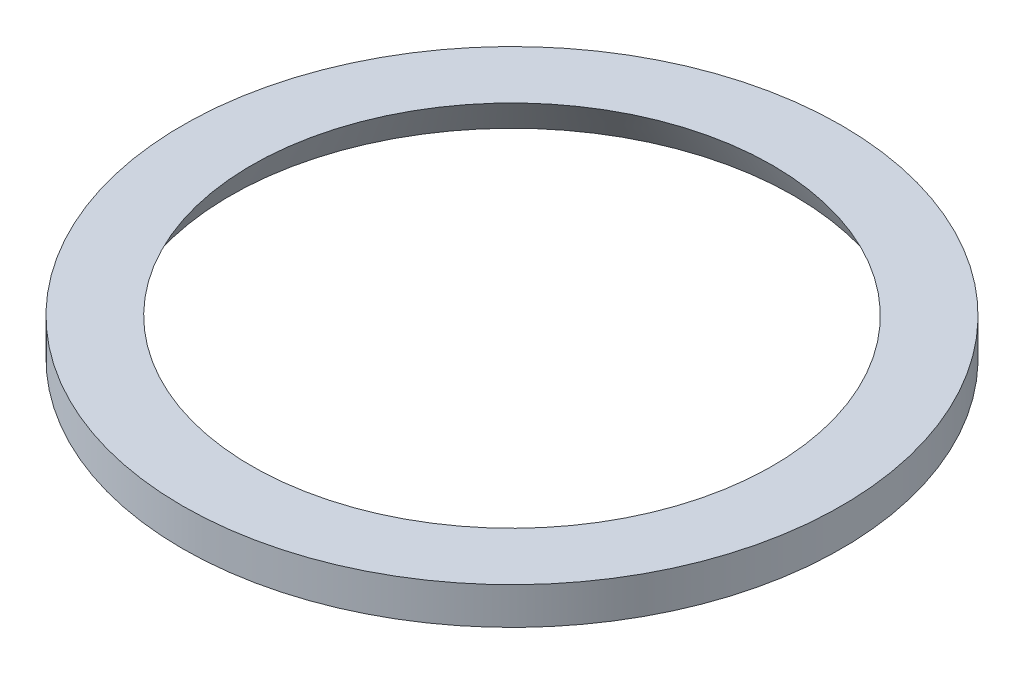
from build123d import *


with BuildPart() as part:
    # Sketch2 → Revolve1 (revolve)
    with BuildSketch(Plane.XY, mode=Mode.PRIVATE) as revolve1_sk:
        Polygon((-89, 0), (-89, 10), (-70.339745962, 10), (-76.113248654, 0), align=None)
    revolve(revolve1_sk.sketch.rotate(Axis((0, 0, 0), (0, 1, 0)), 270), axis=Axis((0, 0, 0), (0, 1, 0)))


solid = part.part
